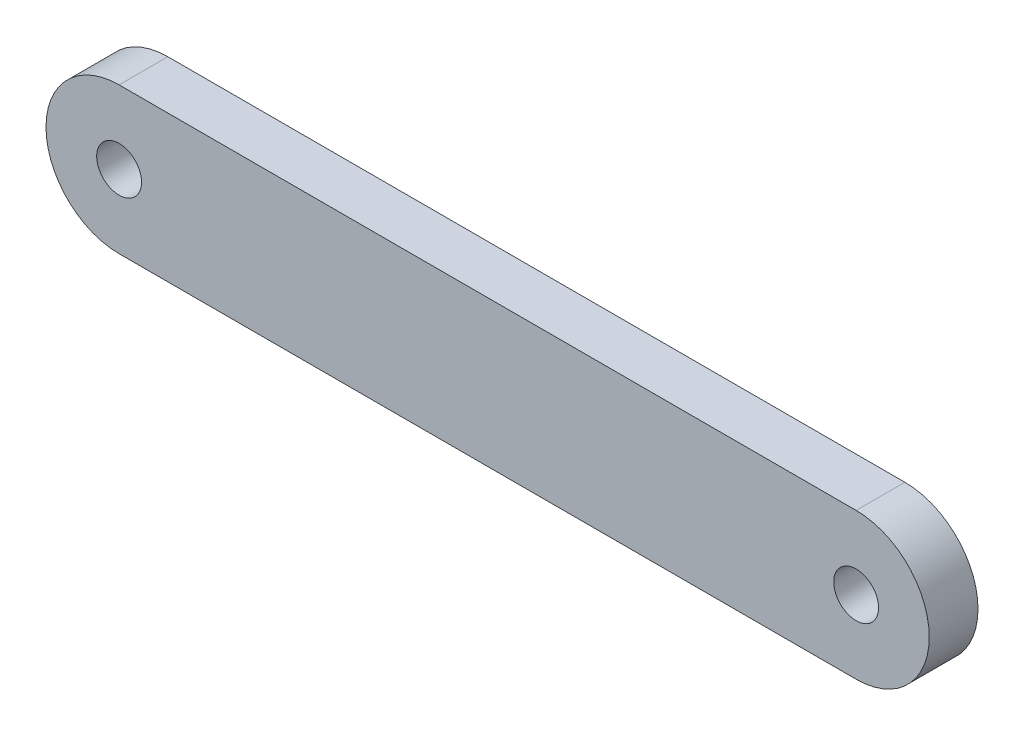
from build123d import *

# Parameters (mm, degrees)
SKETCH_1_R      = 2.3
EXTRUDE_1_DEPTH = 5


with BuildPart() as part:
    # 草图1 → 凸台-拉伸1 (new body)
    with BuildSketch(Plane.XY):
        with BuildLine():
            Line((-37.8, 7.5), (37.8, 7.5))
            ThreePointArc((37.8, 7.5), (45.3, 0), (37.8, -7.5))
            Line((37.8, -7.5), (-37.8, -7.5))
            ThreePointArc((-37.8, -7.5), (-45.3, 0), (-37.8, 7.5))
        make_face()
        with Locations((-37.8, 0)):
            Circle(SKETCH_1_R, mode=Mode.SUBTRACT)
        with Locations((37.8, 0)):
            Circle(SKETCH_1_R, mode=Mode.SUBTRACT)
    extrude(amount=EXTRUDE_1_DEPTH)


solid = part.part
